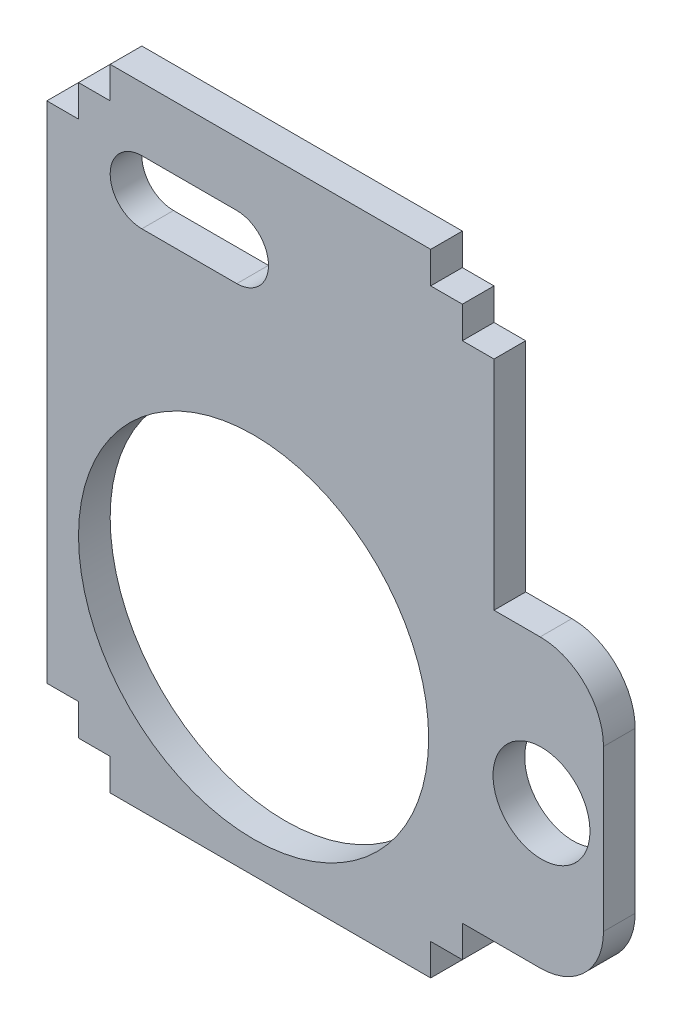
from build123d import *

# Parameters (mm, degrees)
SKETCH1_R           = 35.1155
SKETCH1_R_2         = 9.7234375
BOSS_EXTRUDE1_DEPTH = 6.35
CUT_EXTRUDE1_DEPTH  = 114.602654559


with BuildPart() as part:
    # Sketch1 → Boss-Extrude1 (new body)
    with BuildSketch(Plane.XY):
        with BuildLine():
            Line((75.062413888, -16.133650292), (75.062413888, 15.997349708))
            ThreePointArc((75.062413888, 15.997349708), (71.342670009, 24.977605829), (62.362413888, 28.697349708))
            Line((62.362413888, 28.697349708), (53.104113888, 28.697349708))
            Line((53.104113888, 28.697349708), (53.104113888, 72.334549708))
            Line((53.104113888, 72.334549708), (46.754113888, 72.334549708))
            Line((46.754113888, 72.334549708), (46.754113888, 78.684549708))
            Line((46.754113888, 78.684549708), (40.404113888, 78.684549708))
            Line((40.404113888, 78.684549708), (40.404113888, 85.034549708))
            Line((40.404113888, 85.034549708), (-23.883286112, 85.034549708))
            Line((-23.883286112, 85.034549708), (-23.883286112, 78.684549708))
            Line((-23.883286112, 78.684549708), (-30.233286112, 78.684549708))
            Line((-30.233286112, 78.684549708), (-30.233286112, 72.334549708))
            Line((-30.233286112, 72.334549708), (-36.583286112, 72.334549708))
            Line((-36.583286112, 72.334549708), (-36.583286112, -28.833650292))
            Line((-36.583286112, -28.833650292), (-30.233286112, -28.833650292))
            Line((-30.233286112, -28.833650292), (-30.233286112, -35.183650292))
            Line((-30.233286112, -35.183650292), (-23.883286112, -35.183650292))
            Line((-23.883286112, -35.183650292), (-23.883286112, -41.533650292))
            Line((-23.883286112, -41.533650292), (40.404113888, -41.533650292))
            Line((40.404113888, -41.533650292), (40.404113888, -35.183650292))
            Line((40.404113888, -35.183650292), (46.754113888, -35.183650292))
            Line((46.754113888, -35.183650292), (46.754113888, -28.833650292))
            Line((46.754113888, -28.833650292), (62.362413888, -28.833650292))
            ThreePointArc((62.362413888, -28.833650292), (71.342670009, -25.113906413), (75.062413888, -16.133650292))
        make_face()
        with Locations((4.882213888, -0.068150292)):
            Circle(SKETCH1_R, mode=Mode.SUBTRACT)
        with Locations((62.629113888, -0.068150292)):
            Circle(SKETCH1_R_2, mode=Mode.SUBTRACT)
    extrude(amount=-BOSS_EXTRUDE1_DEPTH)

    # Sketch2 → Cut-Extrude1 (cut, through all)
    with BuildSketch(Plane.XY):
        with BuildLine():
            Line((-17.533286112, 59.634549708), (1.516713888, 59.634549708))
            ThreePointArc((1.516713888, 59.634549708), (7.866713888, 65.984549708), (1.516713888, 72.334549708))
            Line((1.516713888, 72.334549708), (-17.533286112, 72.334549708))
            ThreePointArc((-17.533286112, 72.334549708), (-23.883286112, 65.984549708), (-17.533286112, 59.634549708))
        make_face()
    extrude(amount=-CUT_EXTRUDE1_DEPTH, mode=Mode.SUBTRACT)


solid = part.part
